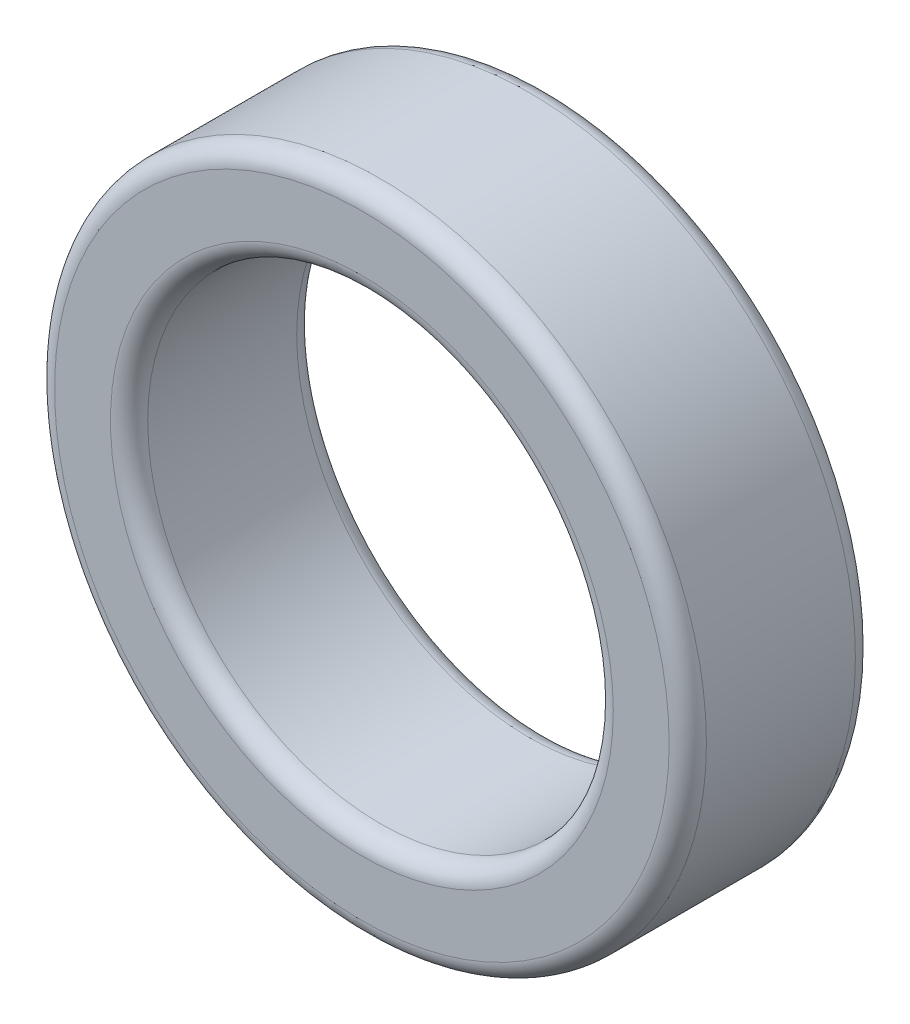
from build123d import *

# Parameters (mm, degrees)
IZIM1_R                     = 35
IZIM1_R_2                   = 25
Y_KSEKLIK_EKSTR_ZYON1_DEPTH = 20
RADYUS1_R                   = 2


with BuildPart() as part:
    # Çizim1 → Yükseklik-Ekstrüzyon1 (new body)
    with BuildSketch(Plane.XY):
        Circle(IZIM1_R)
        Circle(IZIM1_R_2, mode=Mode.SUBTRACT)
    extrude(amount=Y_KSEKLIK_EKSTR_ZYON1_DEPTH)

    # Radyus1
    radyus1_edges = [part.edges().sort_by_distance(p)[0] for p in [
        (-35, 0, 0),
        (-35, 0, 20),
        (-25, 0, 0),
        (-25, 0, 20),
    ]]
    fillet(radyus1_edges, radius=RADYUS1_R)


solid = part.part
